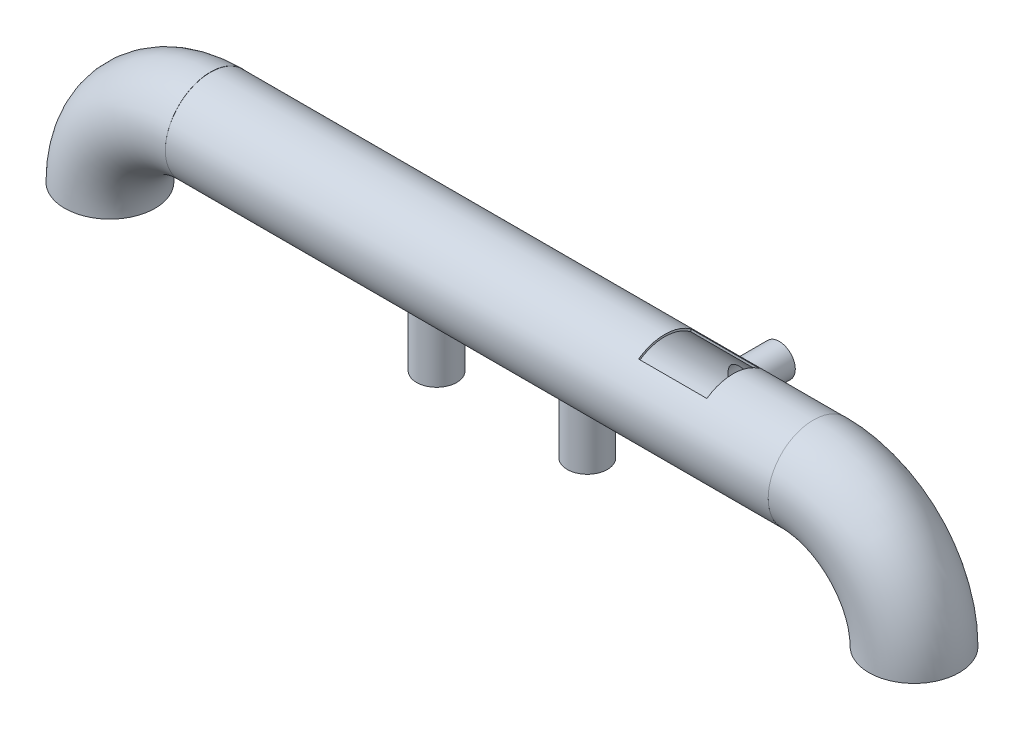
from build123d import *

# Parameters (mm, degrees)
CROQUIS1_R                   = 10
SALIENTE_EXTRUIR1_DEPTH      = 40
SALIENTE_EXTRUIR1_2_DEPTH    = 40
SALIENTE_EXTRUIR2_DEPTH      = 150
SALIENTE_EXTRUIR2_DEPTH_BACK = 150
CROQUIS2_R                   = 22.5
CROQUIS6_R                   = 22.5
CROQUIS6_R_2                 = 21.5
REVOLUCI_N1_ANGLE            = 90
CORTAR_EXTRUIR2_START        = 60
CROQUIS7_W                   = 34
CROQUIS7_H                   = 26
CORTAR_EXTRUIR2_DEPTH        = 20
CROQUIS8_R                   = 8
SALIENTE_EXTRUIR3_DEPTH      = 40
CORTAR_EXTRUIR3_START        = -27
CROQUIS9_R                   = 7
CORTAR_EXTRUIR3_DEPTH        = 25
CROQUIS4_R                   = 21.5
CORTAR_EXTRUIR1_DEPTH        = 296


with BuildPart() as part:
    # Croquis1 → Saliente-Extruir1 (new body)
    with BuildSketch(Plane(origin=(0, 0, 0), x_dir=(1, 0, 0), z_dir=(0, 1, 0))):
        with Locations(Location((-37.5, 0, 0), (0, 0, 270))):
            Circle(CROQUIS1_R)
    extrude(amount=SALIENTE_EXTRUIR1_DEPTH)



with BuildPart() as body_2:
    # Croquis1 → Saliente-Extruir1 2 (new body)
    with BuildSketch(Plane(origin=(0, 0, 0), x_dir=(1, 0, 0), z_dir=(0, 1, 0))):
        with Locations(Location((37.5, 0, 0), (0, 0, 270))):
            Circle(CROQUIS1_R)
    extrude(amount=SALIENTE_EXTRUIR1_2_DEPTH)


with BuildPart() as part_1:
    add(part.part)

    add(body_2.part)  # Saliente-Extruir2 merges body 2
    # Croquis2 → Saliente-Extruir2 (add, two sides: drawn at the far end of the back side and taken through both)
    with BuildSketch(Plane(origin=(0, 0, 0), x_dir=(0, 0, -1), z_dir=(1, 0, 0)).offset(-SALIENTE_EXTRUIR2_DEPTH_BACK)):
        with Locations((0, 50)):
            Circle(CROQUIS2_R)
    extrude(amount=SALIENTE_EXTRUIR2_DEPTH + SALIENTE_EXTRUIR2_DEPTH_BACK)

    # Croquis6 → Revolución1 (revolve)
    with BuildSketch(Plane(origin=(150, 0, -150), x_dir=(0, 0, 1), z_dir=(-1, 0, 0))):
        with Locations((150, 50.102446163)):
            Circle(CROQUIS6_R)
        with Locations((150, 50.102446163)):
            Circle(CROQUIS6_R_2, mode=Mode.SUBTRACT)
    revoluci_n1 = revolve(axis=Axis((150, 0, 25.625), (0, 0, -1)), revolution_arc=REVOLUCI_N1_ANGLE)

    # Simetría1: Revolución1 across plane
    add(revoluci_n1.mirror(Plane(origin=(0, 0, 0), x_dir=(0, 0, 1), z_dir=(1, 0, 0))))

    # Croquis7 → Cortar-Extruir2 (cut)
    with BuildSketch(Plane(origin=(0, 0, 0), x_dir=(1, 0, 0), z_dir=(0, 1, 0)).offset(CORTAR_EXTRUIR2_START)):
        with Locations((93, 0)):
            Rectangle(CROQUIS7_W, CROQUIS7_H)
    extrude(amount=CORTAR_EXTRUIR2_DEPTH, mode=Mode.SUBTRACT)

    # Croquis8 → Saliente-Extruir3 (add)
    with BuildSketch(Plane.XY):
        with Locations((93, 50)):
            Circle(CROQUIS8_R)
    extrude(amount=-SALIENTE_EXTRUIR3_DEPTH)

    # Croquis9 → Cortar-Extruir3 (cut)
    with BuildSketch(Plane(origin=(0, 0, -40), x_dir=(-1, 0, 0), z_dir=(0, 0, -1)).offset(CORTAR_EXTRUIR3_START)):
        with Locations(Location((-93, 50, 0), (0, 0, 180))):
            Circle(CROQUIS9_R)
    extrude(amount=CORTAR_EXTRUIR3_DEPTH, mode=Mode.SUBTRACT)

    # Croquis4 → Cortar-Extruir1 (cut)
    with BuildSketch(Plane(origin=(150, 0, 0), x_dir=(0, 0, -1), z_dir=(1, 0, 0))):
        with Locations((0, 50)):
            Circle(CROQUIS4_R)
    extrude(amount=-CORTAR_EXTRUIR1_DEPTH, mode=Mode.SUBTRACT)


solid = part_1.part
